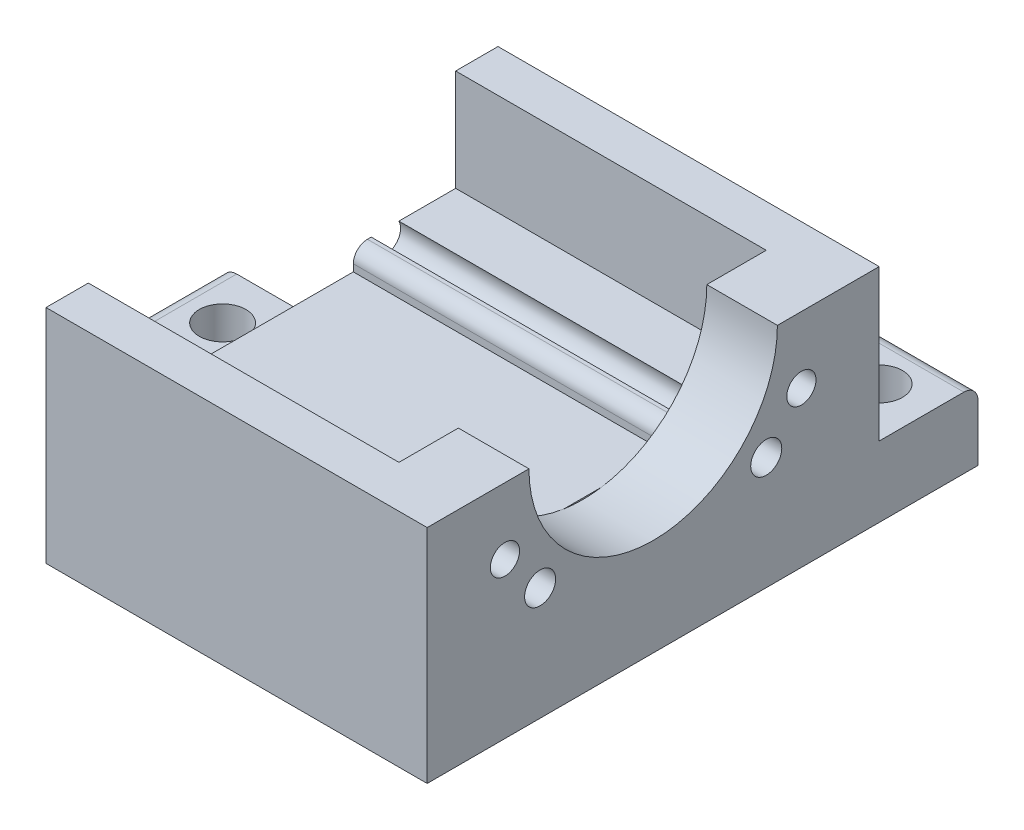
from build123d import *

# Parameters (mm, degrees)
BOSS_EXTRUDE1_DEPTH = 11
SKETCH3_W           = 22
SKETCH3_H           = 3
BOSS_EXTRUDE2_DEPTH = 15.7
BOSS_EXTRUDE3_DEPTH = 5
SKETCH5_R           = 1.035
SKETCH5_R_2         = 1.1
CUT_EXTRUDE1_DEPTH  = 36.096650541
SKETCH6_W           = 7
SKETCH6_H           = 7
BOSS_EXTRUDE4_DEPTH = 5
SKETCH7_R           = 1.65
CUT_EXTRUDE2_DEPTH  = 32.1110829
FILLET1_R           = 1


with BuildPart() as part:
    # Sketch1 → Boss-Extrude1 (new, symmetric)
    with BuildSketch(Plane(origin=(0, 0, 0), x_dir=(0, 0, -1), z_dir=(1, 0, 0))):
        Polygon((-13.0089, 0), (13.0089, 0), (13.0089, 8.5), (5.7589, 8.5), (5.7589, 7), (-5.7589, 7), (-5.7589, 8.5), (-13.0089, 8.5), align=None)
    extrude(amount=BOSS_EXTRUDE1_DEPTH, both=True)

    # Sketch3 → Boss-Extrude2 (add)
    with BuildSketch(Plane.XZ):
        with Locations((0, -14.5089)):
            Rectangle(SKETCH3_W, SKETCH3_H)
        with Locations((0, 14.5089)):
            Rectangle(SKETCH3_W, SKETCH3_H)
    extrude(amount=-BOSS_EXTRUDE2_DEPTH)

    # Sketch4 → Boss-Extrude3 (add)
    with BuildSketch(Plane(origin=(11, 0, 0), x_dir=(0, 0, -1), z_dir=(1, 0, 0))):
        with BuildLine():
            Line((-8.8, 15.7), (-16.0089, 15.7))
            Line((-16.0089, 15.7), (-16.0089, 0))
            Line((-16.0089, 0), (16.0089, 0))
            Line((16.0089, 0), (16.0089, 15.7))
            Line((16.0089, 15.7), (8.8, 15.7))
            ThreePointArc((8.8, 15.7), (0, 6.9), (-8.8, 15.7))
        make_face()
    extrude(amount=BOSS_EXTRUDE3_DEPTH)

    # Sketch5 → Cut-Extrude1 (cut, through all)
    with BuildSketch(Plane(origin=(16, 0, 0), x_dir=(0, 0, -1), z_dir=(1, 0, 0))):
        with Locations((-10.5, 11)):
            Circle(SKETCH5_R)
        with Locations((10.5, 11)):
            Circle(SKETCH5_R)
        with Locations((-8.0089, 8)):
            Circle(SKETCH5_R_2)
        with Locations(Location((8.0089, 8, 0), (0, 0, 27.035691789))):
            Circle(SKETCH5_R_2)
    extrude(amount=-CUT_EXTRUDE1_DEPTH, mode=Mode.SUBTRACT)

    # Sketch6 → Boss-Extrude4 (add)
    with BuildSketch(Plane.XZ):
        with Locations((12.5, -19.5089)):
            Rectangle(SKETCH6_W, SKETCH6_H)
        with Locations((-14.5, 0)):
            Rectangle(SKETCH6_W, SKETCH6_H)
    extrude(amount=-BOSS_EXTRUDE4_DEPTH)

    # Sketch7 → Cut-Extrude2 (cut, through all)
    with BuildSketch(Plane(origin=(0, 5, 0), x_dir=(1, 0, 0), z_dir=(0, 1, 0))):
        with Locations(Location((-14.5, 0, 0), (0, 0, 270))):
            Circle(SKETCH7_R)
        with Locations(Location((12.5, 19.5089, 0), (0, 0, 270))):
            Circle(SKETCH7_R)
    extrude(amount=-CUT_EXTRUDE2_DEPTH, mode=Mode.SUBTRACT)

    # Fillet1
    fillet1_edges = [part.edges().sort_by_distance(p)[0] for p in [
        (-18, 5, 0),
        (12.5, 5, -23.0089),
        (0, 8.5, 5.7589),
        (0, 8.5, -5.7589),
    ]]
    fillet(fillet1_edges, radius=FILLET1_R)


solid = part.part
